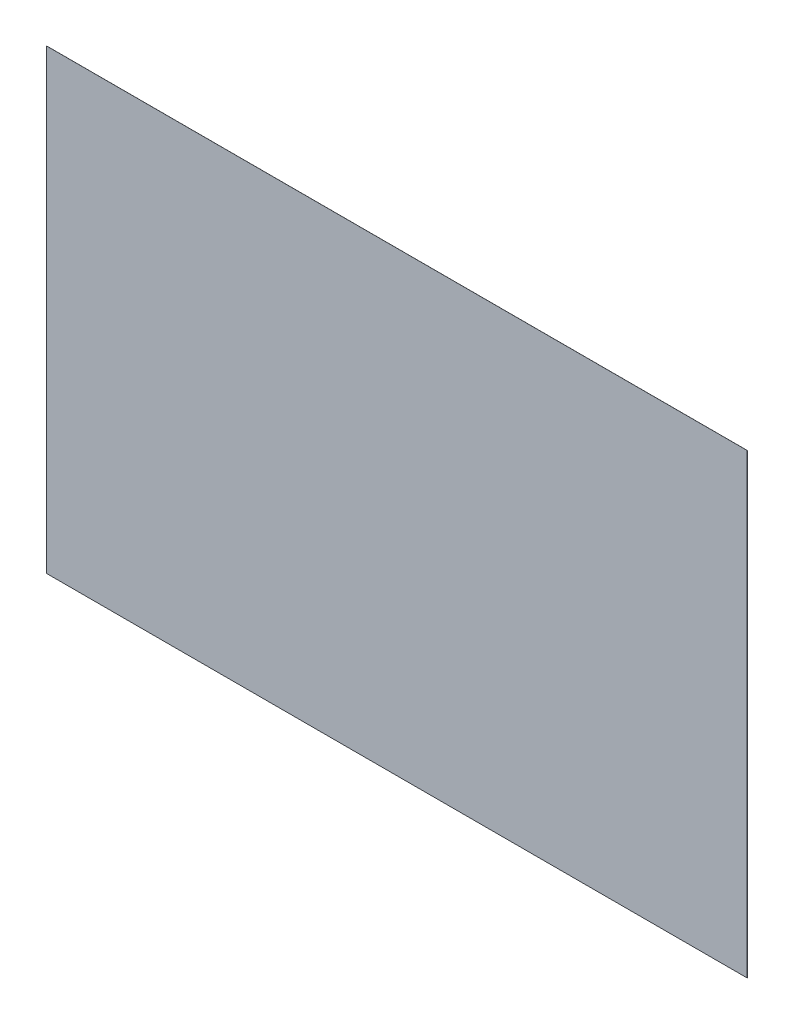
from build123d import *

# Parameters (mm, degrees)
SKETCH1_W           = 575
SKETCH1_H           = 375
BOSS_EXTRUDE1_DEPTH = 0.026


with BuildPart() as part:
    # Sketch1 → Boss-Extrude1 (new, symmetric)
    with BuildSketch(Plane.XY):
        Rectangle(SKETCH1_W, SKETCH1_H)
    extrude(amount=BOSS_EXTRUDE1_DEPTH, both=True)


solid = part.part
